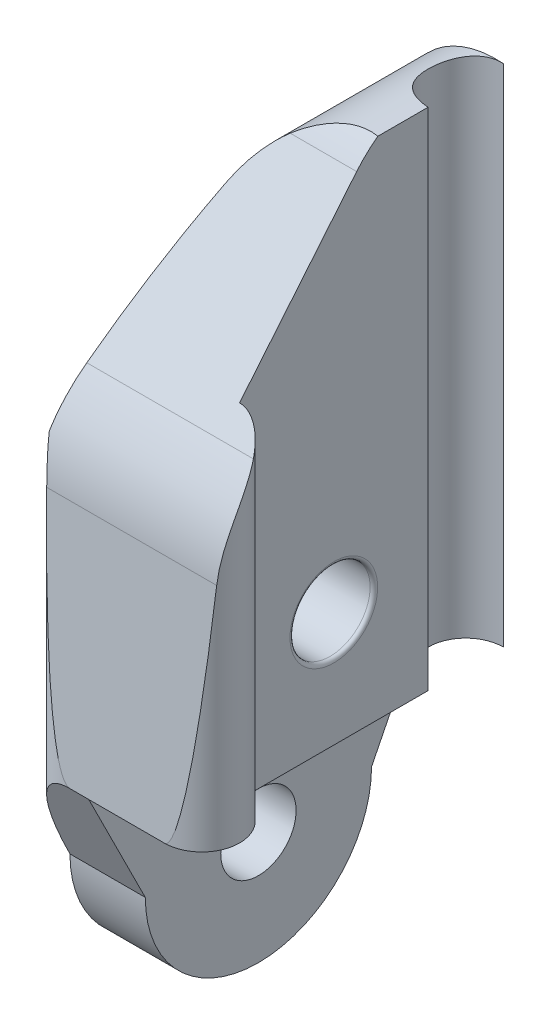
from build123d import *

# Parameters (mm, degrees)
BOSS_EXTRUDE1_DEPTH = 50.8
CUT_EXTRUDE2_START  = -21.59
SKETCH3_R           = 1.27
CUT_EXTRUDE2_DEPTH  = 50.8
CUT_EXTRUDE1_DEPTH  = 50.8
SKETCH4_W           = 10.16
SKETCH4_H           = 15.24
CUT_EXTRUDE3_DEPTH  = 50.8
SKETCH5_R           = 2.54
CUT_EXTRUDE5_DEPTH  = 50.8
CUT_EXTRUDE6_DEPTH  = 32.512
CUT_EXTRUDE7_DEPTH  = 32.512
CUT_EXTRUDE12_START = -10.16
SKETCH14_R          = 2.7
CUT_EXTRUDE12_DEPTH = 9.08
CUT_EXTRUDE9_DEPTH  = 38.608
BOSS_EXTRUDE2_START = -4.2
SKETCH15_R          = 2.7
BOSS_EXTRUDE2_DEPTH = 4.2
FILLET1_R           = 0.254
SKETCH16_R          = 1.7526
CUT_EXTRUDE13_DEPTH = 3.556


with BuildPart() as part:
    # Sketch1 → Boss-Extrude1 (new body)
    with BuildSketch(Plane(origin=(0, 0, 0), x_dir=(1, 0, 0), z_dir=(0, 1, 0))):
        with BuildLine():
            Line((-20.32, 27.095319289), (-20.32, 11.855319289))
            ThreePointArc((-20.32, 11.855319289), (-19.204076836, 9.161242453), (-16.51, 8.045319289))
            Line((-16.51, 8.045319289), (-3.81, 8.045319289))
            ThreePointArc((-3.81, 8.045319289), (-1.115923164, 9.161242453), (0, 11.855319289))
            Line((0, 11.855319289), (0, 27.095319289))
            ThreePointArc((0, 27.095319289), (-1.115923164, 29.789396126), (-3.81, 30.905319289))
            Line((-3.81, 30.905319289), (-16.51, 30.905319289))
            ThreePointArc((-16.51, 30.905319289), (-19.204076836, 29.789396126), (-20.32, 27.095319289))
        make_face()
    extrude(amount=BOSS_EXTRUDE1_DEPTH)

    # Sketch3 → Cut-Extrude2 (cut)
    with BuildSketch(Plane(origin=(0, 50.8, 0), x_dir=(1, 0, 0), z_dir=(0, 1, 0)).offset(CUT_EXTRUDE2_START)):
        with Locations(Location((-10.16, 10.585319289, 0), (0, 0, 270))):
            Circle(SKETCH3_R)
        with Locations(Location((-10.16, 28.365319289, 0), (0, 0, 270))):
            Circle(SKETCH3_R)
    extrude(amount=-CUT_EXTRUDE2_DEPTH, mode=Mode.SUBTRACT)

    # Sketch2 → Cut-Extrude1 (cut)
    with BuildSketch(Plane.ZY.offset(20.32)):
        with BuildLine():
            Line((-27.095319289, 7.62), (-30.905319289, 15.24))
            Line((-30.905319289, 15.24), (-30.905319289, -5.08))
            Line((-30.905319289, -5.08), (-8.045319289, -5.08))
            Line((-8.045319289, -5.08), (-8.045319289, 15.24))
            Line((-8.045319289, 15.24), (-11.855319289, 7.62))
            ThreePointArc((-11.855319289, 7.62), (-19.475319289, 0), (-27.095319289, 7.62))
        make_face()
    extrude(amount=-CUT_EXTRUDE1_DEPTH, mode=Mode.SUBTRACT)

    # Sketch4 → Cut-Extrude3 (cut)
    with BuildSketch(Plane.XY.offset(-8.045319289)):
        with Locations((-10.16, 7.62)):
            Rectangle(SKETCH4_W, SKETCH4_H)
    extrude(amount=-CUT_EXTRUDE3_DEPTH, mode=Mode.SUBTRACT)

    # Sketch5 → Cut-Extrude5 (cut)
    with BuildSketch(Plane.ZY.offset(20.32)):
        with Locations((-19.475319289, 7.62)):
            Circle(SKETCH5_R)
    extrude(amount=-CUT_EXTRUDE5_DEPTH, mode=Mode.SUBTRACT)

    # Sketch6 → Cut-Extrude6 (cut)
    with BuildSketch(Plane.ZY.offset(20.32)):
        with BuildLine():
            Line((-11.855319289, 36.846817341), (-21.012334943, 47.93447962))
            ThreePointArc((-21.012334943, 47.93447962), (-23.733254983, 50.047756788), (-27.095319289, 50.8))
            Line((-27.095319289, 50.8), (-31.52544936, 50.8))
            Line((-31.52544936, 50.8), (-31.52544936, 15.08846866))
            Line((-31.52544936, 15.08846866), (-40.392656277, 51.934271372))
            Line((-40.392656277, 51.934271372), (12.273740193, 71.26134954))
            Line((12.273740193, 71.26134954), (-8.045319289, 15.24))
            Line((-8.045319289, 15.24), (-9.357524517, 30.725540243))
            ThreePointArc((-9.357524517, 30.725540243), (-10.139323425, 33.97677891), (-11.855319289, 36.846817341))
        make_face()
    extrude(amount=-CUT_EXTRUDE6_DEPTH, mode=Mode.SUBTRACT)

    # Sketch7 → Cut-Extrude7 (cut)
    with BuildSketch(Plane(origin=(0, 0, -30.905319289), x_dir=(-1, 0, 0), z_dir=(0, 0, -1))):
        with BuildLine():
            Line((0, 29.335182296), (-12.852337187, 67.804770192))
            Line((-12.852337187, 67.804770192), (37.594938904, 66.861563092))
            Line((37.594938904, 66.861563092), (20.32, 29.335182296))
            ThreePointArc((20.32, 29.335182296), (19.06442366, 37.382371637), (16.68228589, 45.170769925))
            ThreePointArc((16.68228589, 45.170769925), (10.662952429, 49.301878805), (4.643618968, 45.170769925))
            ThreePointArc((4.643618968, 45.170769925), (1.994617848, 37.348921605), (0, 29.335182296))
        make_face()
    extrude(amount=-CUT_EXTRUDE7_DEPTH, mode=Mode.SUBTRACT)

    # Sketch14 → Cut-Extrude12 (cut)
    with BuildSketch(Plane(origin=(0, 0, 0), x_dir=(0, 0, -1), z_dir=(1, 0, 0)).offset(CUT_EXTRUDE12_START)):
        with Locations((19.475319289, 22.985182296)):
            Circle(SKETCH14_R)
    extrude(amount=-CUT_EXTRUDE12_DEPTH, mode=Mode.SUBTRACT)

    # Sketch8 → Cut-Extrude9 (cut, symmetric)
    with BuildSketch(Plane.XZ.offset(-15.24)):
        with BuildLine():
            Line((-10.16, -13.125319289), (-10.16, -25.825319289))
            ThreePointArc((-10.16, -25.825319289), (-12.7, -28.365319289), (-10.16, -30.905319289))
            Line((-10.16, -30.905319289), (15.115555145, -54.006547143))
            Line((15.115555145, -54.006547143), (12.290345115, 18.720711385))
            Line((12.290345115, 18.720711385), (-10.16, -8.045319289))
            ThreePointArc((-10.16, -8.045319289), (-7.62, -10.585319289), (-10.16, -13.125319289))
        make_face()
    extrude(amount=CUT_EXTRUDE9_DEPTH, both=True, mode=Mode.SUBTRACT)

    # Sketch15 → Boss-Extrude2 (add)
    with BuildSketch(Plane.ZY.offset(20.32).offset(BOSS_EXTRUDE2_START)):
        with Locations((-19.475319289, 22.985182296)):
            Circle(SKETCH15_R)
    extrude(amount=BOSS_EXTRUDE2_DEPTH)

    # Fillet1
    fillet1_edges = [part.edges().sort_by_distance(p)[0] for p in [
        (-10.16, 22.985182296, -16.775319289),
    ]]
    fillet(fillet1_edges, radius=FILLET1_R)

    # Sketch16 → Cut-Extrude13 (cut)
    with BuildSketch(Plane(origin=(-16.12, 0, 0), x_dir=(0, 0, -1), z_dir=(1, 0, 0))):
        with Locations((19.475319289, 22.985182296)):
            Circle(SKETCH16_R)
    extrude(amount=-CUT_EXTRUDE13_DEPTH, mode=Mode.SUBTRACT)


solid = part.part
